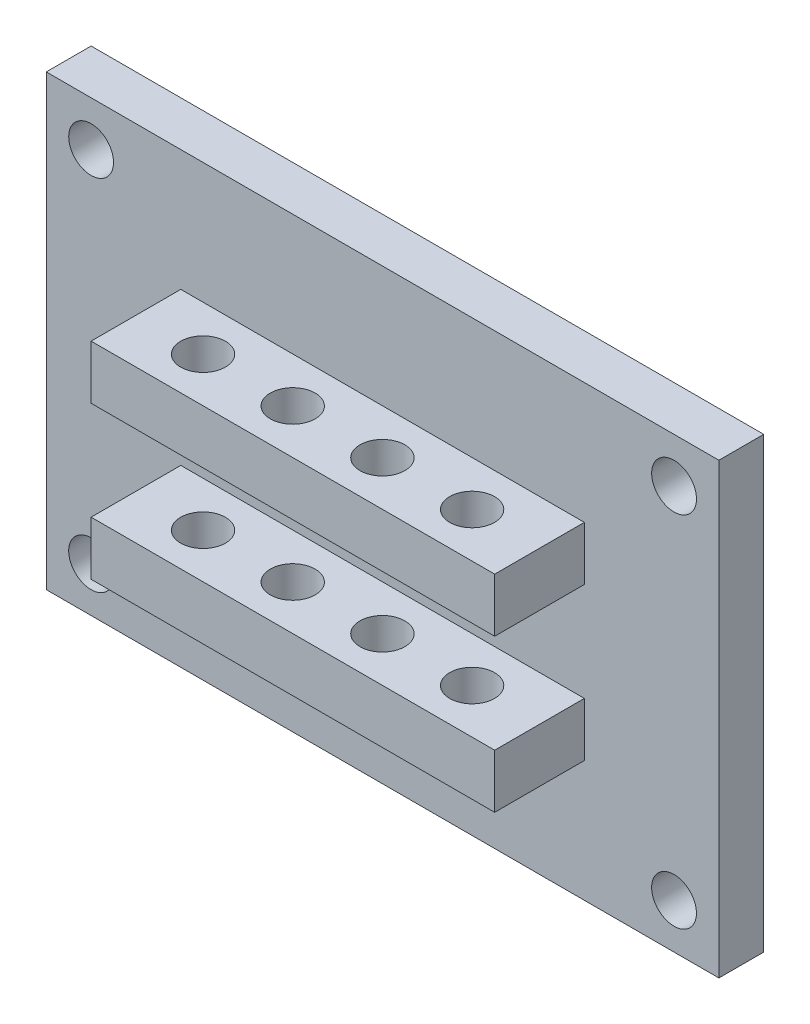
from build123d import *

# Parameters (mm, degrees)
ESQUISSE1_W             = 45
ESQUISSE1_H             = 6
BOSS_EXTRU_1_DEPTH      = 10
BOSS_EXTRU_1_2_DEPTH    = 10
ESQUISSE2_W             = 75
ESQUISSE2_H             = 50
ESQUISSE2_R             = 2.5
BOSS_EXTRU_2_DEPTH      = 5
ENL_V_MAT_EXTRU_1_REACH = 55.278
ESQUISSE3_R             = 2.5


with BuildPart() as part:
    # Esquisse1 → Boss.-Extru.1 (new body)
    with BuildSketch(Plane.XY):
        with Locations((0, 8.5)):
            Rectangle(ESQUISSE1_W, ESQUISSE1_H)
    extrude(amount=BOSS_EXTRU_1_DEPTH)



with BuildPart() as body_2:
    # Esquisse1 → Boss.-Extru.1 2 (new body)
    with BuildSketch(Plane.XY):
        with Locations((0, -8.5)):
            Rectangle(ESQUISSE1_W, ESQUISSE1_H)
    extrude(amount=BOSS_EXTRU_1_2_DEPTH)


with BuildPart() as part_1:
    add(part.part)

    add(body_2.part)  # Boss.-Extru.2 merges body 2
    # Esquisse2 → Boss.-Extru.2 (add)
    with BuildSketch(Plane(origin=(0, 0, 0), x_dir=(-1, 0, 0), z_dir=(0, 0, -1))):
        Rectangle(ESQUISSE2_W, ESQUISSE2_H)
        with Locations((32.5, 20)):
            Circle(ESQUISSE2_R, mode=Mode.SUBTRACT)
        with Locations(Location((-32.5, 20, 0), (0, 0, 180))):
            Circle(ESQUISSE2_R, mode=Mode.SUBTRACT)
        with Locations((-32.5, -20)):
            Circle(ESQUISSE2_R, mode=Mode.SUBTRACT)
        with Locations(Location((32.5, -20, 0), (0, 0, 180))):
            Circle(ESQUISSE2_R, mode=Mode.SUBTRACT)
    extrude(amount=BOSS_EXTRU_2_DEPTH)

    # Enlèv. mat.-Extru.1: up to this face of the body (flat: up to its plane)
    enl_v_mat_extru_1_end = Plane(part_1.part.faces().sort_by_distance((0, 11.5, 5))[0])
    # Esquisse3 → Enlèv. mat.-Extru.1 (cut, up to the picked face)
    with BuildSketch(Plane.XZ.offset(11.5), mode=Mode.PRIVATE) as enl_v_mat_extru_1_sk1:
        with Locations(Location((-5, 5.0183964, 0), (0, 0, 270))):
            Circle(ESQUISSE3_R)
    enl_v_mat_extru_1_tool1 = split(extrude(enl_v_mat_extru_1_sk1.sketch, amount=-ENL_V_MAT_EXTRU_1_REACH, mode=Mode.PRIVATE), bisect_by=enl_v_mat_extru_1_end, keep=Keep.BOTH, mode=Mode.PRIVATE)
    # Esquisse3 → Enlèv. mat.-Extru.1 (cut, up to the picked face)
    with BuildSketch(Plane.XZ.offset(11.5), mode=Mode.PRIVATE) as enl_v_mat_extru_1_sk2:
        with Locations(Location((5, 5.0183964, 0), (0, 0, 270))):
            Circle(ESQUISSE3_R)
    enl_v_mat_extru_1_tool2 = split(extrude(enl_v_mat_extru_1_sk2.sketch, amount=-ENL_V_MAT_EXTRU_1_REACH, mode=Mode.PRIVATE), bisect_by=enl_v_mat_extru_1_end, keep=Keep.BOTH, mode=Mode.PRIVATE)
    # Esquisse3 → Enlèv. mat.-Extru.1 (cut, up to the picked face)
    with BuildSketch(Plane.XZ.offset(11.5), mode=Mode.PRIVATE) as enl_v_mat_extru_1_sk3:
        with Locations(Location((15, 5.0183964, 0), (0, 0, 270))):
            Circle(ESQUISSE3_R)
    enl_v_mat_extru_1_tool3 = split(extrude(enl_v_mat_extru_1_sk3.sketch, amount=-ENL_V_MAT_EXTRU_1_REACH, mode=Mode.PRIVATE), bisect_by=enl_v_mat_extru_1_end, keep=Keep.BOTH, mode=Mode.PRIVATE)
    # Esquisse3 → Enlèv. mat.-Extru.1 (cut, up to the picked face)
    with BuildSketch(Plane.XZ.offset(11.5), mode=Mode.PRIVATE) as enl_v_mat_extru_1_sk4:
        with Locations(Location((-15, 5.0183964, 0), (0, 0, 270))):
            Circle(ESQUISSE3_R)
    enl_v_mat_extru_1_tool4 = split(extrude(enl_v_mat_extru_1_sk4.sketch, amount=-ENL_V_MAT_EXTRU_1_REACH, mode=Mode.PRIVATE), bisect_by=enl_v_mat_extru_1_end, keep=Keep.BOTH, mode=Mode.PRIVATE)
    add(enl_v_mat_extru_1_tool1.solids().sort_by(Axis((-5, -11.5, 5.018396), (0, 1, 0)))[0], mode=Mode.SUBTRACT)
    add(enl_v_mat_extru_1_tool2.solids().sort_by(Axis((5, -11.5, 5.018396), (0, 1, 0)))[0], mode=Mode.SUBTRACT)
    add(enl_v_mat_extru_1_tool3.solids().sort_by(Axis((15, -11.5, 5.018396), (0, 1, 0)))[0], mode=Mode.SUBTRACT)
    add(enl_v_mat_extru_1_tool4.solids().sort_by(Axis((-15, -11.5, 5.018396), (0, 1, 0)))[0], mode=Mode.SUBTRACT)


solid = part_1.part
